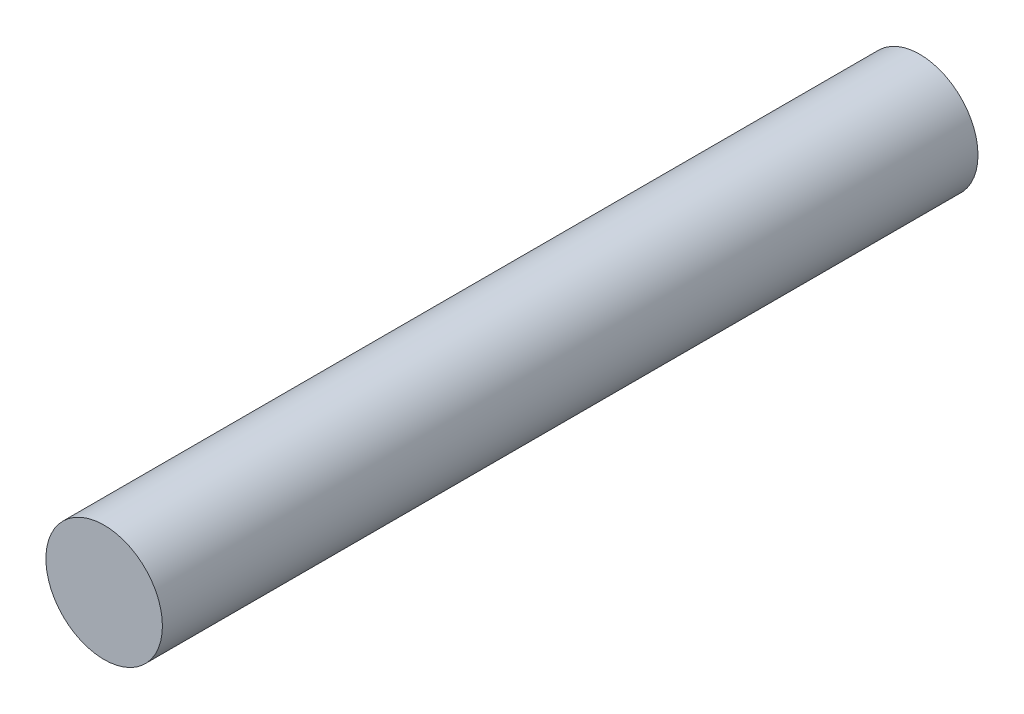
from build123d import *

# Parameters (mm, degrees)
CROQUIS1_R              = 12.7
SALIENTE_EXTRUIR1_DEPTH = 177.8


with BuildPart() as part:
    # Croquis1 → Saliente-Extruir1 (new body)
    with BuildSketch(Plane.XY):
        Circle(CROQUIS1_R)
    extrude(amount=SALIENTE_EXTRUIR1_DEPTH)


solid = part.part
